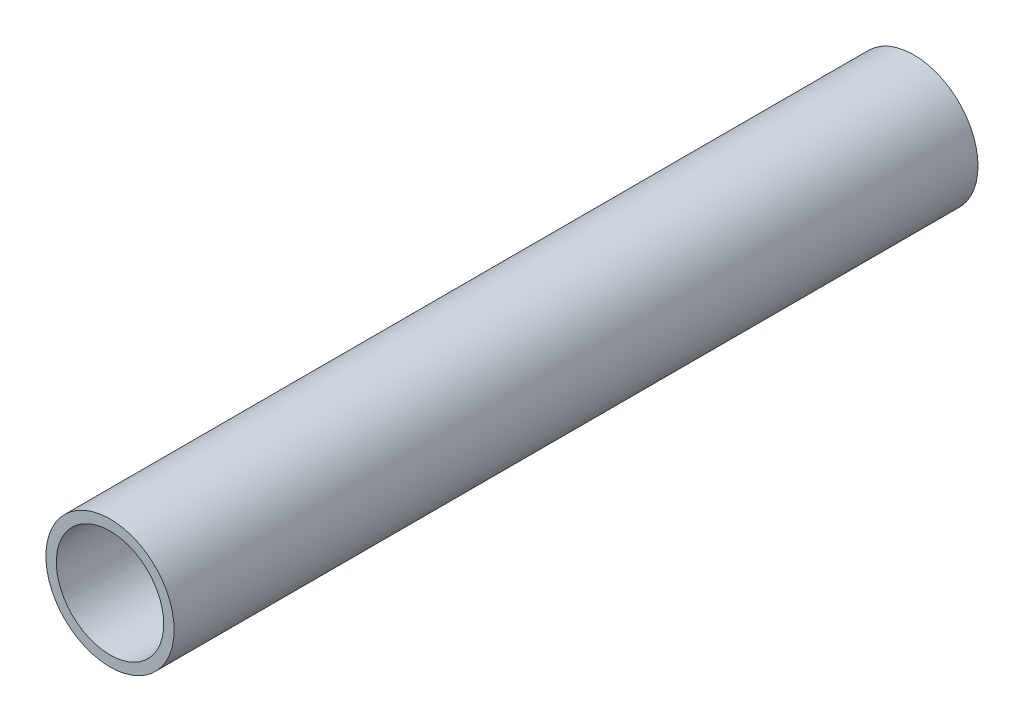
from build123d import *

# Parameters (mm, degrees)
ESQUISSE1_R        = 5.525
ESQUISSE1_R_2      = 4.625
BOSS_EXTRU_1_DEPTH = 69.24


with BuildPart() as part:
    # Esquisse1 → Boss.-Extru.1 (new body)
    with BuildSketch(Plane.XY):
        Circle(ESQUISSE1_R)
        Circle(ESQUISSE1_R_2, mode=Mode.SUBTRACT)
    extrude(amount=BOSS_EXTRU_1_DEPTH)


solid = part.part
